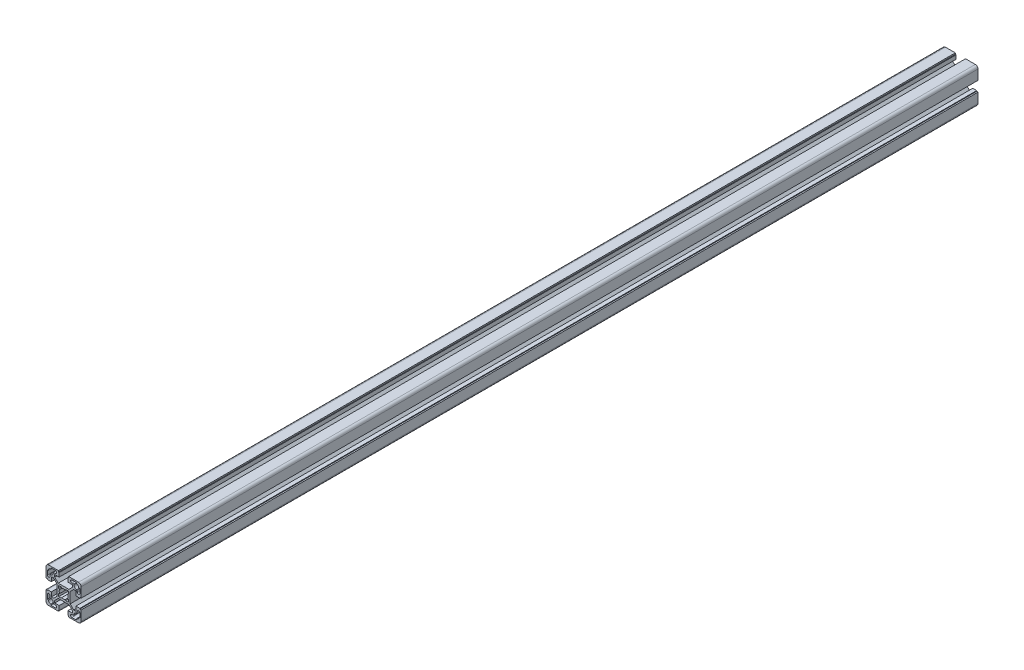
from build123d import *

# Parameters (mm, degrees)
EXTRUDE1_DEPTH = 1020


with BuildPart() as part:
    # Sketch1 → Extrude1 (new body)
    with BuildSketch(Plane.XY):
        with BuildLine():
            Line((5.8, -20), (17, -20))
            ThreePointArc((17, -20), (19.121320344, -19.121320344), (20, -17))
            Line((20, -17), (20, -5.8))
            Line((20, -5.8), (18.5, -5.8))
            Line((18.5, -5.8), (18.5, -5))
            Line((18.5, -5), (14, -5))
            Line((14, -5), (14, -10.05))
            Line((14, -10.05), (11.464213562, -10.05))
            Line((11.464213562, -10.05), (7.5, -6.085786438))
            Line((7.5, -6.085786438), (7.5, 6.085786438))
            Line((7.5, 6.085786438), (11.464213562, 10.05))
            Line((11.464213562, 10.05), (14, 10.05))
            Line((14, 10.05), (14, 5))
            Line((14, 5), (18.5, 5))
            Line((18.5, 5), (18.5, 5.8))
            Line((18.5, 5.8), (20, 5.8))
            Line((20, 5.8), (20, 17))
            ThreePointArc((20, 17), (19.121320344, 19.121320344), (17, 20))
            Line((17, 20), (5.8, 20))
            Line((5.8, 20), (5.8, 18.5))
            Line((5.8, 18.5), (5, 18.5))
            Line((5, 18.5), (5, 14))
            Line((5, 14), (10.05, 14))
            Line((10.05, 14), (10.05, 11.464213562))
            Line((10.05, 11.464213562), (6.085786438, 7.5))
            Line((6.085786438, 7.5), (-6.085786438, 7.5))
            Line((-6.085786438, 7.5), (-10.05, 11.464213562))
            Line((-10.05, 11.464213562), (-10.05, 14))
            Line((-10.05, 14), (-5, 14))
            Line((-5, 14), (-5, 18.5))
            Line((-5, 18.5), (-5.8, 18.5))
            Line((-5.8, 18.5), (-5.8, 20))
            Line((-5.8, 20), (-17, 20))
            ThreePointArc((-17, 20), (-19.121320344, 19.121320344), (-20, 17))
            Line((-20, 17), (-20, 5.8))
            Line((-20, 5.8), (-18.5, 5.8))
            Line((-18.5, 5.8), (-18.5, 5))
            Line((-18.5, 5), (-14, 5))
            Line((-14, 5), (-14, 10.05))
            Line((-14, 10.05), (-11.464213562, 10.05))
            Line((-11.464213562, 10.05), (-7.5, 6.085786438))
            Line((-7.5, 6.085786438), (-7.5, -6.085786438))
            Line((-7.5, -6.085786438), (-11.464213562, -10.05))
            Line((-11.464213562, -10.05), (-14, -10.05))
            Line((-14, -10.05), (-14, -5))
            Line((-14, -5), (-18.5, -5))
            Line((-18.5, -5), (-18.5, -5.8))
            Line((-18.5, -5.8), (-20, -5.8))
            Line((-20, -5.8), (-20, -17))
            ThreePointArc((-20, -17), (-19.121320344, -19.121320344), (-17, -20))
            Line((-17, -20), (-5.8, -20))
            Line((-5.8, -20), (-5.8, -18.5))
            Line((-5.8, -18.5), (-5, -18.5))
            Line((-5, -18.5), (-5, -14))
            Line((-5, -14), (-10.05, -14))
            Line((-10.05, -14), (-10.05, -11.464213562))
            Line((-10.05, -11.464213562), (-6.085786438, -7.5))
            Line((-6.085786438, -7.5), (6.085786438, -7.5))
            Line((6.085786438, -7.5), (10.05, -11.464213562))
            Line((10.05, -11.464213562), (10.05, -14))
            Line((10.05, -14), (5, -14))
            Line((5, -14), (5, -18.5))
            Line((5, -18.5), (5.8, -18.5))
            Line((5.8, -18.5), (5.8, -20))
        make_face()
        with BuildLine():
            Line((14.5, -18.5), (9.5, -18.5))
            ThreePointArc((9.5, -18.5), (8, -17), (9.5, -15.5))
            Line((9.5, -15.5), (11.75, -15.5))
            Line((11.75, -15.5), (11.75, -14.5))
            ThreePointArc((11.75, -14.5), (12.555456352, -12.555456352), (14.5, -11.75))
            Line((14.5, -11.75), (15.5, -11.75))
            Line((15.5, -11.75), (15.5, -9.5))
            ThreePointArc((15.5, -9.5), (17, -8), (18.5, -9.5))
            Line((18.5, -9.5), (18.5, -14.5))
            Line((18.5, -14.5), (17.25, -14.5))
            ThreePointArc((17.25, -14.5), (16.444543648, -16.444543648), (14.5, -17.25))
            Line((14.5, -17.25), (14.5, -18.5))
        make_face(mode=Mode.SUBTRACT)
        with BuildLine():
            Line((18.5, 14.5), (17.25, 14.5))
            ThreePointArc((17.25, 14.5), (16.444543648, 16.444543648), (14.5, 17.25))
            Line((14.5, 17.25), (14.5, 18.5))
            Line((14.5, 18.5), (9.5, 18.5))
            ThreePointArc((9.5, 18.5), (8, 17), (9.5, 15.5))
            Line((9.5, 15.5), (11.75, 15.5))
            Line((11.75, 15.5), (11.75, 14.5))
            ThreePointArc((11.75, 14.5), (12.555456352, 12.555456352), (14.5, 11.75))
            Line((14.5, 11.75), (15.5, 11.75))
            Line((15.5, 11.75), (15.5, 9.5))
            ThreePointArc((15.5, 9.5), (17, 8), (18.5, 9.5))
            Line((18.5, 9.5), (18.5, 14.5))
        make_face(mode=Mode.SUBTRACT)
        with BuildLine():
            Line((5.5, 5.5), (2.397915762, 5.5))
            Line((2.397915762, 5.5), (1.998263135, 4.583333333))
            ThreePointArc((1.998263135, 4.583333333), (0, 5), (-1.998263135, 4.583333333))
            Line((-1.998263135, 4.583333333), (-2.397915762, 5.5))
            Line((-2.397915762, 5.5), (-5.5, 5.5))
            Line((-5.5, 5.5), (-5.5, 2.397915762))
            Line((-5.5, 2.397915762), (-4.583333333, 1.998263135))
            ThreePointArc((-4.583333333, 1.998263135), (-5, 0), (-4.583333333, -1.998263135))
            Line((-4.583333333, -1.998263135), (-5.5, -2.397915762))
            Line((-5.5, -2.397915762), (-5.5, -5.5))
            Line((-5.5, -5.5), (-2.397915762, -5.5))
            Line((-2.397915762, -5.5), (-1.998263135, -4.583333333))
            ThreePointArc((-1.998263135, -4.583333333), (0, -5), (1.998263135, -4.583333333))
            Line((1.998263135, -4.583333333), (2.397915762, -5.5))
            Line((2.397915762, -5.5), (5.5, -5.5))
            Line((5.5, -5.5), (5.5, -2.397915762))
            Line((5.5, -2.397915762), (4.583333333, -1.998263135))
            ThreePointArc((4.583333333, -1.998263135), (5, 0), (4.583333333, 1.998263135))
            Line((4.583333333, 1.998263135), (5.5, 2.397915762))
            Line((5.5, 2.397915762), (5.5, 5.5))
        make_face(mode=Mode.SUBTRACT)
        with BuildLine():
            Line((-18.5, -14.5), (-17.25, -14.5))
            ThreePointArc((-17.25, -14.5), (-16.444543648, -16.444543648), (-14.5, -17.25))
            Line((-14.5, -17.25), (-14.5, -18.5))
            Line((-14.5, -18.5), (-9.5, -18.5))
            ThreePointArc((-9.5, -18.5), (-8, -17), (-9.5, -15.5))
            Line((-9.5, -15.5), (-11.75, -15.5))
            Line((-11.75, -15.5), (-11.75, -14.5))
            ThreePointArc((-11.75, -14.5), (-12.555456352, -12.555456352), (-14.5, -11.75))
            Line((-14.5, -11.75), (-15.5, -11.75))
            Line((-15.5, -11.75), (-15.5, -9.5))
            ThreePointArc((-15.5, -9.5), (-17, -8), (-18.5, -9.5))
            Line((-18.5, -9.5), (-18.5, -14.5))
        make_face(mode=Mode.SUBTRACT)
        with BuildLine():
            Line((-14.5, 18.5), (-9.5, 18.5))
            ThreePointArc((-9.5, 18.5), (-8, 17), (-9.5, 15.5))
            Line((-9.5, 15.5), (-11.75, 15.5))
            Line((-11.75, 15.5), (-11.75, 14.5))
            ThreePointArc((-11.75, 14.5), (-12.555456352, 12.555456352), (-14.5, 11.75))
            Line((-14.5, 11.75), (-15.5, 11.75))
            Line((-15.5, 11.75), (-15.5, 9.5))
            ThreePointArc((-15.5, 9.5), (-17, 8), (-18.5, 9.5))
            Line((-18.5, 9.5), (-18.5, 14.5))
            Line((-18.5, 14.5), (-17.25, 14.5))
            ThreePointArc((-17.25, 14.5), (-16.444543648, 16.444543648), (-14.5, 17.25))
            Line((-14.5, 17.25), (-14.5, 18.5))
        make_face(mode=Mode.SUBTRACT)
    extrude(amount=EXTRUDE1_DEPTH)


solid = part.part
